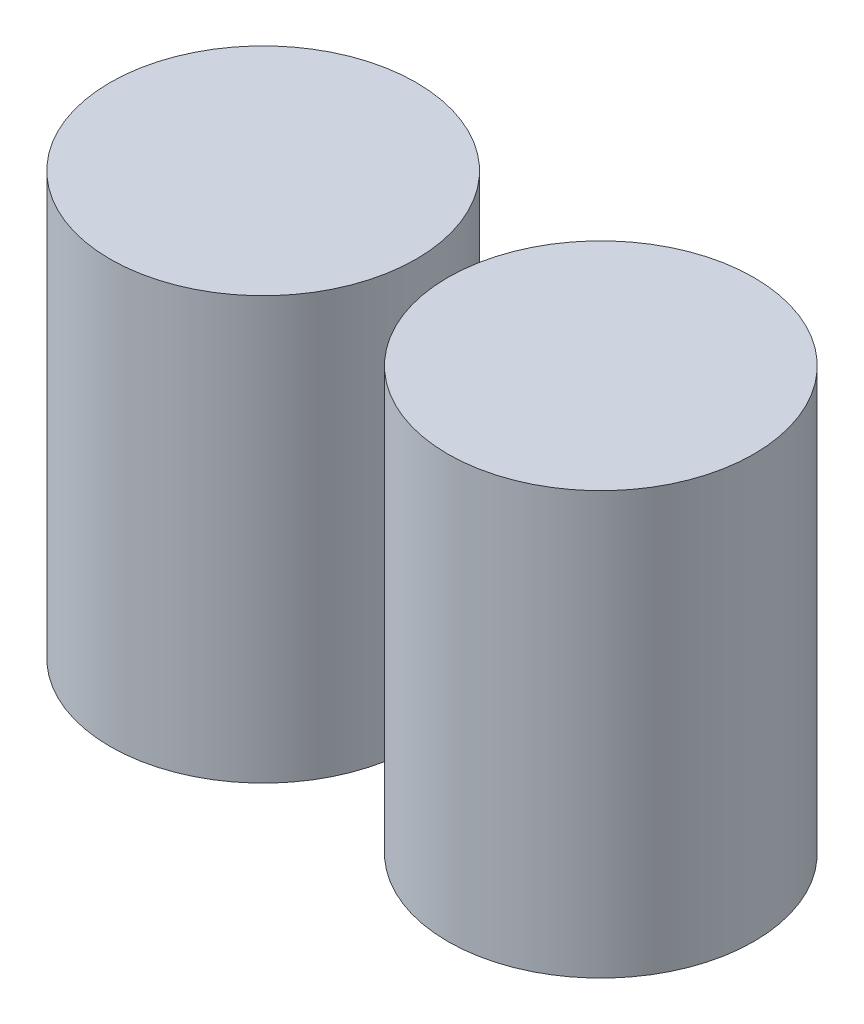
from build123d import *

# Parameters (mm, degrees)
SKETCH2_R             = 14.5
BOSS_EXTRUDE1_DEPTH   = 40
BOSS_EXTRUDE1_2_DEPTH = 40


with BuildPart() as part:
    # Sketch2 → Boss-Extrude1 (new body)
    with BuildSketch(Plane(origin=(0, 0, 0), x_dir=(1, 0, 0), z_dir=(0, 1, 0))):
        with Locations(Location((0, 0, 0), (0, 0, 270))):
            Circle(SKETCH2_R)
    extrude(amount=BOSS_EXTRUDE1_DEPTH)


with BuildPart() as body_2:
    # Sketch2 → Boss-Extrude1 2 (new body)
    with BuildSketch(Plane(origin=(0, 0, 0), x_dir=(1, 0, 0), z_dir=(0, 1, 0))):
        with Locations(Location((32, 0, 0), (0, 0, 270))):
            Circle(SKETCH2_R)
    extrude(amount=BOSS_EXTRUDE1_2_DEPTH)


solid = Compound([part.part, body_2.part])
